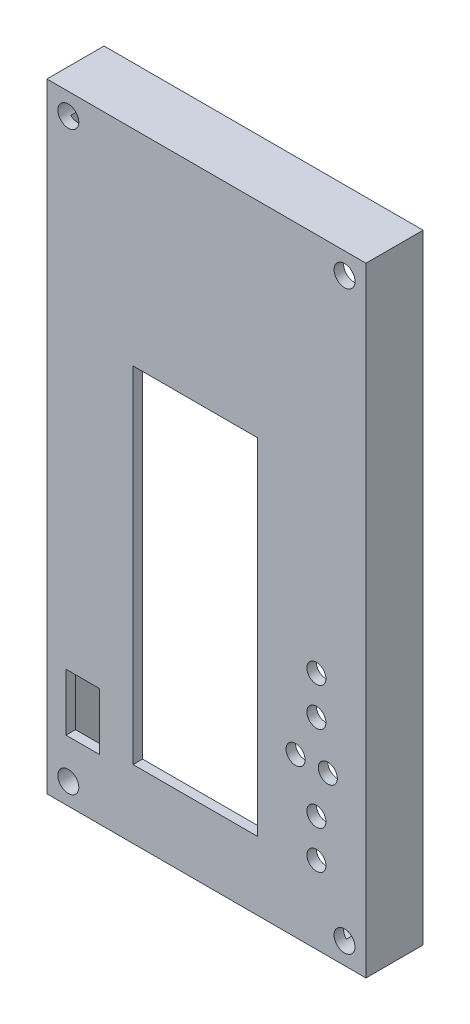
from build123d import *

# Parameters (mm, degrees)
SKETCH1_W           = 67
SKETCH1_H           = 130
SKETCH1_W_2         = 61
SKETCH1_H_2         = 124
BOSS_EXTRUDE1_DEPTH = 10
SKETCH2_W           = 67
SKETCH2_H           = 130
SKETCH2_W_2         = 26.1
SKETCH2_H_2         = 72.5
SKETCH2_W_3         = 7
SKETCH2_H_3         = 11.999999998
BOSS_EXTRUDE2_DEPTH = 2
SKETCH3_R           = 2
CUT_EXTRUDE1_DEPTH  = 78.042717027
SKETCH4_R           = 2.2
CUT_EXTRUDE2_DEPTH  = 78.042717027


with BuildPart() as part:
    # Sketch1 → Boss-Extrude1 (new body)
    with BuildSketch(Plane.XY):
        with Locations((0, -3.332497736)):
            Rectangle(SKETCH1_W, SKETCH1_H)
        with Locations((0, -3.332497736)):
            Rectangle(SKETCH1_W_2, SKETCH1_H_2, mode=Mode.SUBTRACT)
    extrude(amount=BOSS_EXTRUDE1_DEPTH)

    # Sketch2 → Boss-Extrude2 (add)
    with BuildSketch(Plane.XY.offset(10)):
        with Locations((0, -3.332497736)):
            Rectangle(SKETCH2_W, SKETCH2_H)
        with Locations((-2.35, -17.717502264)):
            Rectangle(SKETCH2_W_2, SKETCH2_H_2, mode=Mode.SUBTRACT)
        with Locations((-26, -49.667502265)):
            Rectangle(SKETCH2_W_3, SKETCH2_H_3, mode=Mode.SUBTRACT)
    extrude(amount=BOSS_EXTRUDE2_DEPTH)

    # Sketch3 → Cut-Extrude1 (cut, through all)
    with BuildSketch(Plane.XY.offset(12)):
        with Locations((23.09645, -52.119552264)):
            Circle(SKETCH3_R)
        with Locations((23.09645, -44.115452264)):
            Circle(SKETCH3_R)
        with Locations((18.715647246, -35.063805606)):
            Circle(SKETCH3_R)
        with Locations((23.09645, -26.115452264)):
            Circle(SKETCH3_R)
        with Locations((23.09645, -18.115452264)):
            Circle(SKETCH3_R)
        with Locations((25.496463554, -35.066106361)):
            Circle(SKETCH3_R)
    extrude(amount=-CUT_EXTRUDE1_DEPTH, mode=Mode.SUBTRACT)

    # Sketch4 → Cut-Extrude2 (cut, through all)
    with BuildSketch(Plane.XY.offset(12)):
        with Locations((-29, 57.167502264)):
            Circle(SKETCH4_R)
        with Locations((29, 57.167502264)):
            Circle(SKETCH4_R)
        with Locations((-29, -63.832497736)):
            Circle(SKETCH4_R)
        with Locations((29, -63.832497736)):
            Circle(SKETCH4_R)
    extrude(amount=-CUT_EXTRUDE2_DEPTH, mode=Mode.SUBTRACT)


solid = part.part
